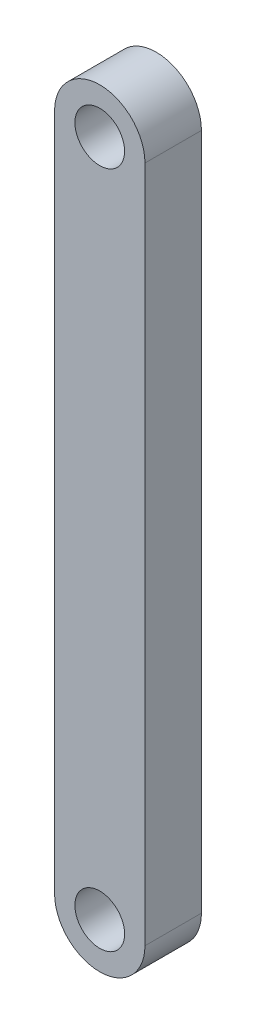
from build123d import *

# Parameters (mm, degrees)
SKETCH1_R           = 2.2
BOSS_EXTRUDE1_DEPTH = 5


with BuildPart() as part:
    # Sketch1 → Boss-Extrude1 (new body)
    with BuildSketch(Plane.XY):
        with BuildLine():
            Line((-4, 60), (-4, 0))
            ThreePointArc((-4, 0), (0, -4), (4, 0))
            Line((4, 0), (4, 60))
            ThreePointArc((4, 60), (0, 64), (-4, 60))
        make_face()
        Circle(SKETCH1_R, mode=Mode.SUBTRACT)
        with Locations((0, 60)):
            Circle(SKETCH1_R, mode=Mode.SUBTRACT)
    extrude(amount=BOSS_EXTRUDE1_DEPTH)


solid = part.part
